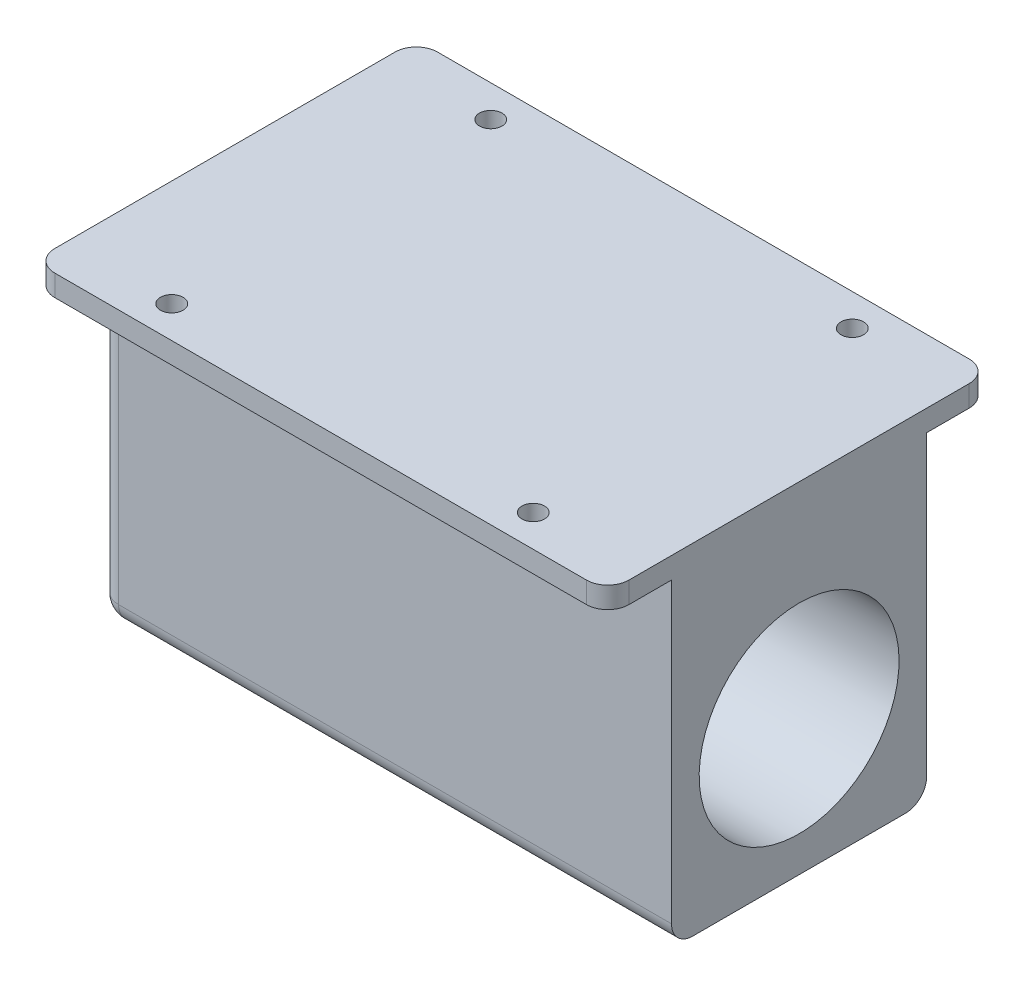
from build123d import *

# Parameters (mm, degrees)
SKETCH_1_W          = 135
SKETCH_1_H          = 80
EXTRUDE_1_DEPTH     = 60
CUT_EXTRUDE_START   = -1.5
CUT_EXTRUDE_1_DEPTH = 57
CUT_EXTRUDE_2_REACH = 170.003
SKETCH_4_R          = 23.5
SKETCH_5_W          = 135
SKETCH_5_H          = 15
EXTRUDE_2_DEPTH     = 5
M5_C_1_D            = 5.3
M5_C_1_DEPTH        = 5.2
M5_C_1_CBORE_D      = 11
M5_C_1_CBORE_DEPTH  = 0.5
M5_C_1_TIP          = 1.59228064
FILLET_1_R          = 5
FILLET_2_R          = 5
FILLET_3_R          = 5


with BuildPart() as part:
    # 草图1 → 凸台-拉伸1 (new body)
    with BuildSketch(Plane.XY):
        with Locations((67.5, -40)):
            Rectangle(SKETCH_1_W, SKETCH_1_H)
    extrude(amount=EXTRUDE_1_DEPTH)

    # 草图2 → 切除-拉伸1 (cut)
    with BuildSketch(Plane.XY.offset(60).offset(CUT_EXTRUDE_START)):
        Polygon((24.108601621, -76.68), (13.8, -76.68), (13.8, -19.68), (68.3, -19.68), (68.3, -76.68), align=None)
    extrude(amount=-CUT_EXTRUDE_1_DEPTH, mode=Mode.SUBTRACT)

    # 草图4 → 切除-拉伸2 (cut, up to next)
    with BuildSketch(Plane(origin=(135, 0, 0), x_dir=(0, 0, -1), z_dir=(1, 0, 0)), mode=Mode.PRIVATE) as cut_extrude_2_sk1:
        with Locations(Location((-30, -48.18, 0), (0, 0, 90))):
            Circle(SKETCH_4_R)
    cut_extrude_2_tool1 = extrude(cut_extrude_2_sk1.sketch, amount=-CUT_EXTRUDE_2_REACH, mode=Mode.PRIVATE) & part.part
    add(cut_extrude_2_tool1.solids().sort_by_distance((135, -48.18, 30))[0], mode=Mode.SUBTRACT)

    # 草图5 → 凸台-拉伸2 (add)
    with BuildSketch(Plane(origin=(0, 0, 0), x_dir=(1, 0, 0), z_dir=(0, 1, 0))):
        with Locations((67.5, 7.5)):
            Rectangle(SKETCH_5_W, SKETCH_5_H)
        with Locations((67.5, -67.5)):
            Rectangle(SKETCH_5_W, SKETCH_5_H)
    extrude(amount=-EXTRUDE_2_DEPTH)

    # M5 六角头螺栓C级的柱形沉头孔1
    with Locations(Plane(origin=(0, -5, 0), x_dir=(-1, 0, 0), z_dir=(0, -1, 0))):
        with Locations((-110, 7.5), (-25, 7.5), (-110, -67.5), (-25, -67.5)):
            CounterBoreHole(M5_C_1_D / 2, M5_C_1_CBORE_D / 2, M5_C_1_CBORE_DEPTH, depth=M5_C_1_DEPTH)
            with Locations((0, 0, -(M5_C_1_DEPTH + M5_C_1_TIP / 2))):  # 118° drill point
                Cone(0, M5_C_1_D / 2, M5_C_1_TIP, mode=Mode.SUBTRACT)

    # 圆角1
    fillet_1_edges = [part.edges().sort_by_distance(p)[0] for p in [
        (0, -42.5, 0),
        (0, -42.5, 60),
    ]]
    fillet(fillet_1_edges, radius=FILLET_1_R)

    # 圆角2
    fillet_2_edges = [part.edges().sort_by_distance(p)[0] for p in [
        (70, -80, 60),
        (70, -80, 0),
        (0, -80, 30),
        (1.464466094, -80, 1.464466094),
        (1.464466094, -80, 58.535533906),
    ]]
    fillet(fillet_2_edges, radius=FILLET_2_R)

    # 圆角3
    fillet_3_edges = [part.edges().sort_by_distance(p)[0] for p in [
        (0, -2.5, -15),
        (135, -2.5, -15),
        (135, -2.5, 75),
        (0, -2.5, 75),
    ]]
    fillet(fillet_3_edges, radius=FILLET_3_R)


solid = part.part
